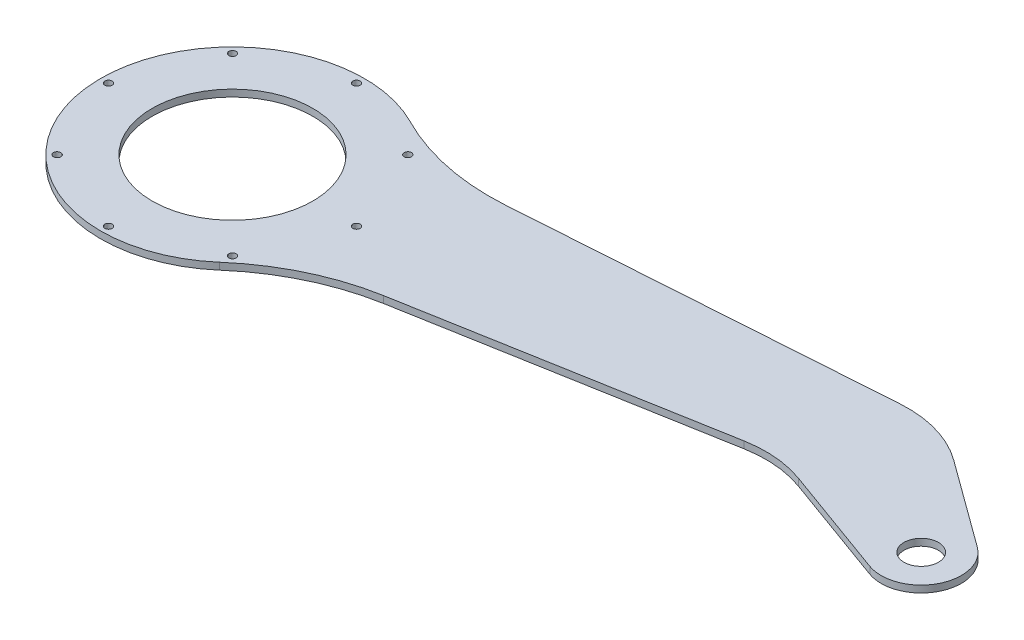
from build123d import *

# Parameters (mm, degrees)
SKETCH1_R           = 1.6
SKETCH1_R_2         = 35
SKETCH1_R_3         = 7.5
BOSS_EXTRUDE2_DEPTH = 3
FILLET1_R           = 50
FILLET2_R           = 100


with BuildPart() as part:
    # Sketch1 → Boss-Extrude2 (new body)
    with BuildSketch(Plane(origin=(0, 0, 0), x_dir=(1, 0, 0), z_dir=(0, 1, 0))):
        with BuildLine():
            Line((257.543524338, 52.623283), (43.136797408, 38.01929391))
            ThreePointArc((43.136797408, 38.01929391), (-57.072915612, -6.99516287), (51.041719813, -26.476269347))
            Line((51.041719813, -26.476269347), (232.634460204, 5.800541986))
            Line((232.634460204, 5.800541986), (294.037229007, -16.452822314))
            ThreePointArc((294.037229007, -16.452822314), (315.449808374, -8.21908883), (310.311776158, 14.139210461))
            Line((310.311776158, 14.139210461), (257.543524338, 52.623283))
        make_face()
        with Locations(Location((38.183766184, 38.183766184, 0), (0, 0, 270))):
            Circle(SKETCH1_R, mode=Mode.SUBTRACT)
        with Locations(Location((0, 0, 0), (0, 0, 270))):
            Circle(SKETCH1_R_2, mode=Mode.SUBTRACT)
        with Locations(Location((54, 0, 0), (0, 0, 270))):
            Circle(SKETCH1_R, mode=Mode.SUBTRACT)
        with Locations(Location((0, 54, 0), (0, 0, 270))):
            Circle(SKETCH1_R, mode=Mode.SUBTRACT)
        with Locations(Location((-38.183766184, 38.183766184, 0), (0, 0, 270))):
            Circle(SKETCH1_R, mode=Mode.SUBTRACT)
        with Locations(Location((-54, 0, 0), (0, 0, 270))):
            Circle(SKETCH1_R, mode=Mode.SUBTRACT)
        with Locations(Location((0, -54, 0), (0, 0, 270))):
            Circle(SKETCH1_R, mode=Mode.SUBTRACT)
        with Locations(Location((-38.183766184, -38.183766184, 0), (0, 0, 270))):
            Circle(SKETCH1_R, mode=Mode.SUBTRACT)
        with Locations(Location((38.183766184, -38.183766184, 0), (0, 0, 270))):
            Circle(SKETCH1_R, mode=Mode.SUBTRACT)
        with Locations(Location((300, 0, 0), (0, 0, 270))):
            Circle(SKETCH1_R_3, mode=Mode.SUBTRACT)
    extrude(amount=BOSS_EXTRUDE2_DEPTH)

    # Fillet1
    fillet1_edges = [part.edges().sort_by_distance(p)[0] for p in [
        (232.634460204, 1.5, -5.800541986),
        (257.543524338, 1.5, -52.623283),
    ]]
    fillet(fillet1_edges, radius=FILLET1_R)

    # Fillet2
    fillet2_edges = [part.edges().sort_by_distance(p)[0] for p in [
        (51.041719813, 1.5, 26.476269347),
        (43.136797408, 1.5, -38.01929391),
    ]]
    fillet(fillet2_edges, radius=FILLET2_R)


solid = part.part
